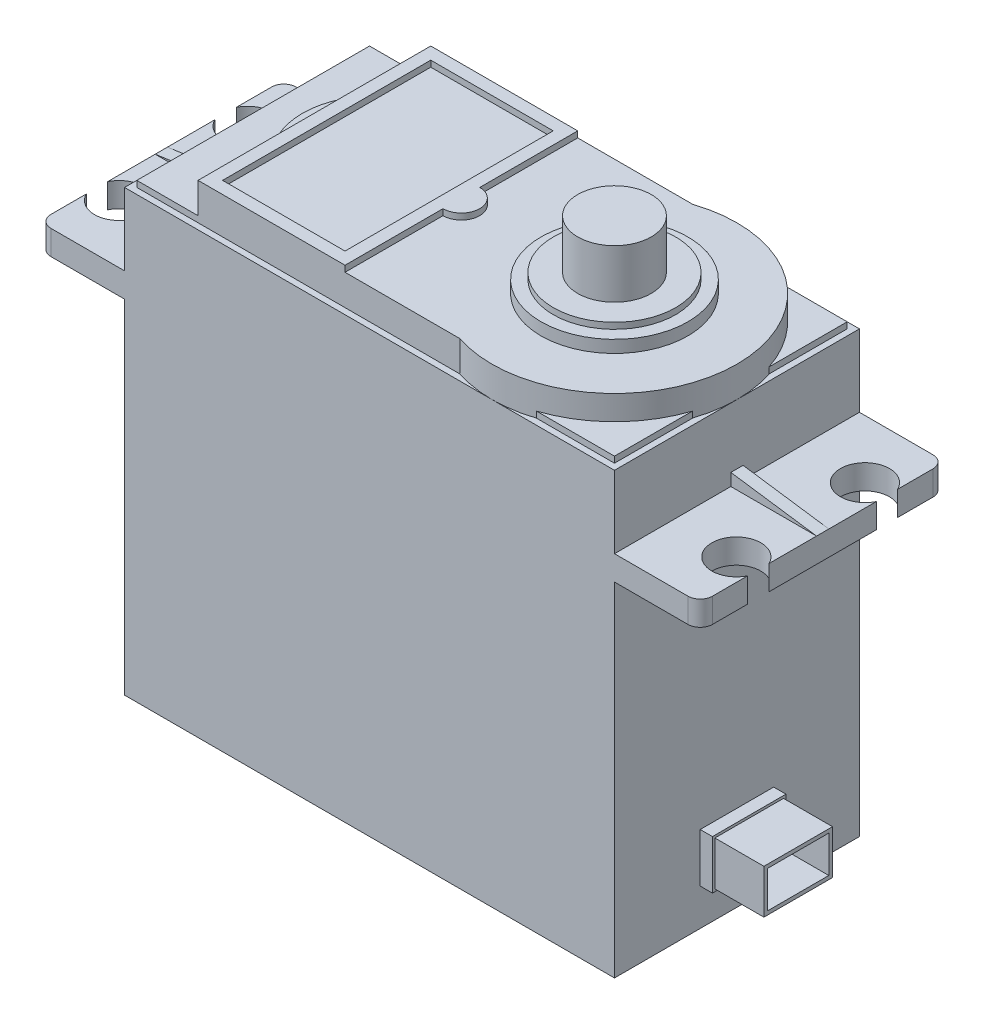
from build123d import *

# Parameters (mm, degrees)
SKETCH1_W            = 40
SKETCH1_H            = 20
BOSS_EXTRUDE1_DEPTH  = 35.9
SKETCH2_W            = 20
SKETCH2_H            = 2
BOSS_EXTRUDE2_DEPTH  = 7
SKETCH3_W            = 7
SKETCH3_H            = 1
BOSS_EXTRUDE3_DEPTH  = 1
CUT_EXTRUDE1_REACH   = 55.852
SKETCH4_R            = 2
FILLET1_R            = 1
CUT_EXTRUDE2_DEPTH   = 11
FILLET1_OF_MIRROR1_R = 1
SKETCH6_W            = 39
SKETCH6_H            = 19
BOSS_EXTRUDE4_DEPTH  = 0.5
BOSS_EXTRUDE5_DEPTH  = 2
SKETCH8_R            = 10
BOSS_EXTRUDE6_DEPTH  = 2.5
SKETCH9_R            = 6
BOSS_EXTRUDE7_DEPTH  = 1
SKETCH10_R           = 5
BOSS_EXTRUDE8_DEPTH  = 0.5
SKETCH11_W           = 10
SKETCH11_H           = 17
BOSS_EXTRUDE9_DEPTH  = 0.5
SKETCH12_R           = 3
BOSS_EXTRUDE10_DEPTH = 4
SKETCH13_W           = 6
SKETCH13_H           = 4
BOSS_EXTRUDE11_DEPTH = 1
SKETCH14_W           = 5.6
SKETCH14_H           = 3.6
SKETCH14_W_2         = 5
SKETCH14_H_2         = 3
BOSS_EXTRUDE12_DEPTH = 4


with BuildPart() as part:
    # Sketch1 → Boss-Extrude1 (new body)
    with BuildSketch(Plane(origin=(0, 0, 0), x_dir=(1, 0, 0), z_dir=(0, 1, 0))):
        with Locations((20, 10)):
            Rectangle(SKETCH1_W, SKETCH1_H)
    extrude(amount=BOSS_EXTRUDE1_DEPTH)

    # Sketch2 → Boss-Extrude2 (add)
    with BuildSketch(Plane(origin=(0, 0, 0), x_dir=(0, 0, -1), z_dir=(1, 0, 0))):
        with Locations((10, 29)):
            Rectangle(SKETCH2_W, SKETCH2_H)
    boss_extrude2 = extrude(amount=-BOSS_EXTRUDE2_DEPTH)

    # Sketch3 → Boss-Extrude3 (add)
    with BuildSketch(Plane(origin=(0, 30, 0), x_dir=(1, 0, 0), z_dir=(0, 1, 0))):
        with Locations((-3.5, 10)):
            Rectangle(SKETCH3_W, SKETCH3_H)
    boss_extrude3 = extrude(amount=BOSS_EXTRUDE3_DEPTH)

    # Sketch4 → Cut-Extrude1 (cut, up to next)
    with BuildSketch(Plane(origin=(0, 30, 0), x_dir=(1, 0, 0), z_dir=(0, 1, 0)), mode=Mode.PRIVATE) as cut_extrude1_sk1:
        with Locations((-5.2, 15.25)):
            Circle(SKETCH4_R)
    cut_extrude1_tool1 = extrude(cut_extrude1_sk1.sketch, amount=-CUT_EXTRUDE1_REACH, mode=Mode.PRIVATE) & part.part
    # Sketch4 → Cut-Extrude1 (cut, up to next)
    with BuildSketch(Plane(origin=(0, 30, 0), x_dir=(1, 0, 0), z_dir=(0, 1, 0)), mode=Mode.PRIVATE) as cut_extrude1_sk2:
        with Locations((-5.2, 4.75)):
            Circle(SKETCH4_R)
    cut_extrude1_tool2 = extrude(cut_extrude1_sk2.sketch, amount=-CUT_EXTRUDE1_REACH, mode=Mode.PRIVATE) & part.part
    cut_extrude1_1 = cut_extrude1_tool1.solids().sort_by_distance((-5.2, 30, -15.25))[0]
    add(cut_extrude1_1, mode=Mode.SUBTRACT)
    cut_extrude1_2 = cut_extrude1_tool2.solids().sort_by_distance((-5.2, 30, -4.75))[0]
    add(cut_extrude1_2, mode=Mode.SUBTRACT)
    cut_extrude1 = cut_extrude1_1 + cut_extrude1_2  # Cut-Extrude1 as one shape, for the pattern or mirror that repeats it

    # Fillet1
    fillet1_edges = [part.edges().sort_by_distance(p)[0] for p in [
        (-7, 29, 0),
        (-7, 29, -20),
    ]]
    fillet(fillet1_edges, radius=FILLET1_R)

    # Sketch5 → Cut-Extrude2 (cut)
    with BuildSketch(Plane.XY.offset(-9.5)):
        Polygon((-7, 30), (0, 31), (-7, 31), align=None)
    cut_extrude2 = extrude(amount=-CUT_EXTRUDE2_DEPTH, mode=Mode.SUBTRACT)

    # Mirror1: Boss-Extrude2, Boss-Extrude3, Cut-Extrude1, Cut-Extrude2 across plane
    add(boss_extrude2.mirror(Plane(origin=(20, 0, 0), x_dir=(0, 0, 1), z_dir=(1, 0, 0))))
    add(boss_extrude3.mirror(Plane(origin=(20, 0, 0), x_dir=(0, 0, 1), z_dir=(1, 0, 0))))
    add(cut_extrude1.mirror(Plane(origin=(20, 0, 0), x_dir=(0, 0, 1), z_dir=(1, 0, 0))), mode=Mode.SUBTRACT)
    add(cut_extrude2.mirror(Plane(origin=(20, 0, 0), x_dir=(0, 0, 1), z_dir=(1, 0, 0))), mode=Mode.SUBTRACT)

    # Fillet1 of Mirror1
    fillet1_of_mirror1_edges = [part.edges().sort_by_distance(p)[0] for p in [
        (47, 29, 0),
        (47, 29, -20),
    ]]
    fillet(fillet1_of_mirror1_edges, radius=FILLET1_OF_MIRROR1_R)

    # Sketch6 → Boss-Extrude4 (add)
    with BuildSketch(Plane(origin=(0, 35.9, 0), x_dir=(1, 0, 0), z_dir=(0, 1, 0))):
        with Locations((20, 10)):
            Rectangle(SKETCH6_W, SKETCH6_H)
    extrude(amount=BOSS_EXTRUDE4_DEPTH)

    # Sketch7 → Boss-Extrude5 (add)
    with BuildSketch(Plane(origin=(0, 36.4, 0), x_dir=(1, 0, 0), z_dir=(0, 1, 0))):
        with BuildLine():
            Line((5.5, 19.5), (30.5, 19.5))
            Line((30.5, 19.5), (30.5, 0.5))
            Line((30.5, 0.5), (5.5, 0.5))
            Line((5.5, 0.5), (5.5, 6.717431229))
            ThreePointArc((5.5, 6.717431229), (4.518757843, 10), (5.5, 13.282568771))
            Line((5.5, 13.282568771), (5.5, 19.5))
        make_face()
    extrude(amount=BOSS_EXTRUDE5_DEPTH)

    # Sketch8 → Boss-Extrude6 (add)
    with BuildSketch(Plane(origin=(0, 38.4, 0), x_dir=(1, 0, 0), z_dir=(0, 1, 0))):
        with Locations((30, 10)):
            Circle(SKETCH8_R)
    extrude(amount=-BOSS_EXTRUDE6_DEPTH)

    # Sketch9 → Boss-Extrude7 (add)
    with BuildSketch(Plane(origin=(0, 38.4, 0), x_dir=(1, 0, 0), z_dir=(0, 1, 0))):
        with Locations(Location((30, 10, 0), (0, 0, 270))):
            Circle(SKETCH9_R)
    extrude(amount=BOSS_EXTRUDE7_DEPTH)

    # Sketch10 → Boss-Extrude8 (add)
    with BuildSketch(Plane(origin=(0, 39.4, 0), x_dir=(1, 0, 0), z_dir=(0, 1, 0))):
        with Locations(Location((30, 10, 0), (0, 0, 270))):
            Circle(SKETCH10_R)
    extrude(amount=BOSS_EXTRUDE8_DEPTH)

    # Sketch11 → Boss-Extrude9 (add)
    with BuildSketch(Plane(origin=(0, 38.4, 0), x_dir=(1, 0, 0), z_dir=(0, 1, 0))):
        with BuildLine():
            Line((5.5, 0.5), (17.5, 0.5))
            Line((17.5, 0.5), (17.5, 8.5))
            ThreePointArc((17.5, 8.5), (19, 10), (17.5, 11.5))
            Line((17.5, 11.5), (17.5, 19.5))
            Line((17.5, 19.5), (5.5, 19.5))
            Line((5.5, 19.5), (5.5, 0.5))
        make_face()
        with Locations((11.5, 10)):
            Rectangle(SKETCH11_W, SKETCH11_H, mode=Mode.SUBTRACT)
    extrude(amount=BOSS_EXTRUDE9_DEPTH)

    # Sketch12 → Boss-Extrude10 (add)
    with BuildSketch(Plane(origin=(0, 39.9, 0), x_dir=(1, 0, 0), z_dir=(0, 1, 0))):
        with Locations(Location((30, 10, 0), (0, 0, 270))):
            Circle(SKETCH12_R)
    extrude(amount=BOSS_EXTRUDE10_DEPTH)

    # Sketch13 → Boss-Extrude11 (add)
    with BuildSketch(Plane(origin=(40, 0, 0), x_dir=(0, 0, -1), z_dir=(1, 0, 0))):
        with Locations((10, 5)):
            Rectangle(SKETCH13_W, SKETCH13_H)
    extrude(amount=BOSS_EXTRUDE11_DEPTH)

    # Sketch14 → Boss-Extrude12 (add)
    with BuildSketch(Plane(origin=(41, 0, 0), x_dir=(0, 0, -1), z_dir=(1, 0, 0))):
        with Locations((10, 5)):
            Rectangle(SKETCH14_W, SKETCH14_H)
        with Locations((10, 5)):
            Rectangle(SKETCH14_W_2, SKETCH14_H_2, mode=Mode.SUBTRACT)
    extrude(amount=BOSS_EXTRUDE12_DEPTH)


solid = part.part
